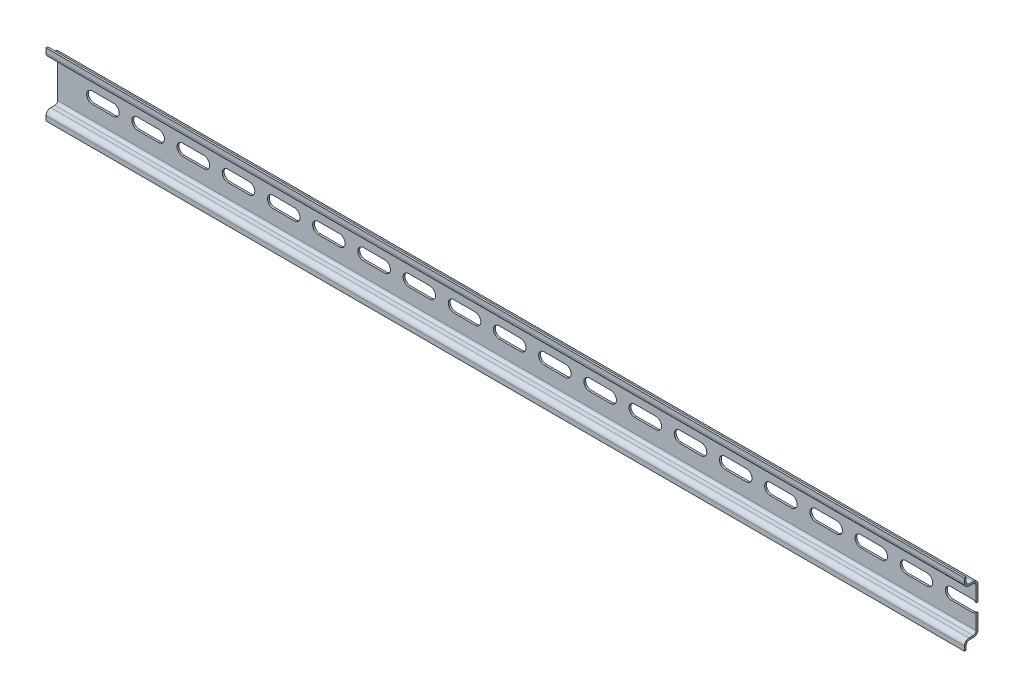
from build123d import *

# Parameters (mm, degrees)
BOSS_EXTRUDE1_DEPTH     = 1000
CUT_EXTRUDE1_DEPTH      = 1001.181688833
FILLET1_R               = 2.54
FILLET2_R               = 1.524
CUT_EXTRUDE2_DEPTH      = 1001.181688833
CUT_EXTRUDE2_DEPTH_BACK = 1001.181688833
SKETCH3_W               = 492
SKETCH3_H               = 35.052


with BuildPart() as part:
    # Sketch1 → Boss-Extrude1 (new body)
    with BuildSketch(Plane(origin=(0, 0, 0), x_dir=(0, 0, -1), z_dir=(1, 0, 0))):
        Polygon((0, 12.446), (0, -12.446), (-6.484, -12.446), (-6.484, -17.526), (-5.484, -17.526), (-5.484, -13.462), (1.016, -13.462), (1.016, 13.462), (-5.484, 13.462), (-5.484, 17.526), (-6.484, 17.526), (-6.484, 12.446), align=None)
    extrude(amount=BOSS_EXTRUDE1_DEPTH)

    # Sketch2 → Cut-Extrude1 (cut, through all)
    with BuildSketch(Plane(origin=(0, 0, -1.016), x_dir=(-1, 0, 0), z_dir=(0, 0, -1))):
        with BuildLine():
            Line((-980.825, 3.175), (-969.175, 3.175))
            ThreePointArc((-969.175, 3.175), (-966, 0), (-969.175, -3.175))
            Line((-969.175, -3.175), (-980.825, -3.175))
            ThreePointArc((-980.825, -3.175), (-984, 0), (-980.825, 3.175))
        make_face()
        with BuildLine():
            Line((-955.824999962, 3.175), (-944.174999962, 3.175))
            ThreePointArc((-944.174999962, 3.175), (-940.999999962, 0), (-944.174999962, -3.175))
            Line((-944.174999962, -3.175), (-955.824999962, -3.175))
            ThreePointArc((-955.824999962, -3.175), (-958.999999962, 0), (-955.824999962, 3.175))
        make_face()
        with BuildLine():
            Line((-930.824999924, 3.175), (-919.174999924, 3.175))
            ThreePointArc((-919.174999924, 3.175), (-915.999999924, 0), (-919.174999924, -3.175))
            Line((-919.174999924, -3.175), (-930.824999924, -3.175))
            ThreePointArc((-930.824999924, -3.175), (-933.999999924, 0), (-930.824999924, 3.175))
        make_face()
        with BuildLine():
            Line((-905.824999886, 3.175), (-894.174999886, 3.175))
            ThreePointArc((-894.174999886, 3.175), (-890.999999886, 0), (-894.174999886, -3.175))
            Line((-894.174999886, -3.175), (-905.824999886, -3.175))
            ThreePointArc((-905.824999886, -3.175), (-908.999999886, 0), (-905.824999886, 3.175))
        make_face()
        with BuildLine():
            Line((-880.824999848, 3.175), (-869.174999848, 3.175))
            ThreePointArc((-869.174999848, 3.175), (-865.999999848, 0), (-869.174999848, -3.175))
            Line((-869.174999848, -3.175), (-880.824999848, -3.175))
            ThreePointArc((-880.824999848, -3.175), (-883.999999848, 0), (-880.824999848, 3.175))
        make_face()
        with BuildLine():
            Line((-855.82499981, 3.175), (-844.17499981, 3.175))
            ThreePointArc((-844.17499981, 3.175), (-840.99999981, 0), (-844.17499981, -3.175))
            Line((-844.17499981, -3.175), (-855.82499981, -3.175))
            ThreePointArc((-855.82499981, -3.175), (-858.99999981, 0), (-855.82499981, 3.175))
        make_face()
        with BuildLine():
            Line((-830.824999772, 3.175), (-819.174999772, 3.175))
            ThreePointArc((-819.174999772, 3.175), (-815.999999772, 0), (-819.174999772, -3.175))
            Line((-819.174999772, -3.175), (-830.824999772, -3.175))
            ThreePointArc((-830.824999772, -3.175), (-833.999999772, 0), (-830.824999772, 3.175))
        make_face()
        with BuildLine():
            Line((-805.824999734, 3.175), (-794.174999734, 3.175))
            ThreePointArc((-794.174999734, 3.175), (-790.999999734, 0), (-794.174999734, -3.175))
            Line((-794.174999734, -3.175), (-805.824999734, -3.175))
            ThreePointArc((-805.824999734, -3.175), (-808.999999734, 0), (-805.824999734, 3.175))
        make_face()
        with BuildLine():
            Line((-780.824999696, 3.175), (-769.174999696, 3.175))
            ThreePointArc((-769.174999696, 3.175), (-765.999999696, 0), (-769.174999696, -3.175))
            Line((-769.174999696, -3.175), (-780.824999696, -3.175))
            ThreePointArc((-780.824999696, -3.175), (-783.999999696, 0), (-780.824999696, 3.175))
        make_face()
        with BuildLine():
            Line((-755.824999658, 3.175), (-744.174999658, 3.175))
            ThreePointArc((-744.174999658, 3.175), (-740.999999658, 0), (-744.174999658, -3.175))
            Line((-744.174999658, -3.175), (-755.824999658, -3.175))
            ThreePointArc((-755.824999658, -3.175), (-758.999999658, 0), (-755.824999658, 3.175))
        make_face()
        with BuildLine():
            Line((-730.82499962, 3.175), (-719.17499962, 3.175))
            ThreePointArc((-719.17499962, 3.175), (-715.99999962, 0), (-719.17499962, -3.175))
            Line((-719.17499962, -3.175), (-730.82499962, -3.175))
            ThreePointArc((-730.82499962, -3.175), (-733.99999962, 0), (-730.82499962, 3.175))
        make_face()
        with BuildLine():
            Line((-705.824999582, 3.175), (-694.174999582, 3.175))
            ThreePointArc((-694.174999582, 3.175), (-690.999999582, 0), (-694.174999582, -3.175))
            Line((-694.174999582, -3.175), (-705.824999582, -3.175))
            ThreePointArc((-705.824999582, -3.175), (-708.999999582, 0), (-705.824999582, 3.175))
        make_face()
        with BuildLine():
            Line((-680.824999544, 3.175), (-669.174999544, 3.175))
            ThreePointArc((-669.174999544, 3.175), (-665.999999544, 0), (-669.174999544, -3.175))
            Line((-669.174999544, -3.175), (-680.824999544, -3.175))
            ThreePointArc((-680.824999544, -3.175), (-683.999999544, 0), (-680.824999544, 3.175))
        make_face()
        with BuildLine():
            Line((-655.824999506, 3.175), (-644.174999506, 3.175))
            ThreePointArc((-644.174999506, 3.175), (-640.999999506, 0), (-644.174999506, -3.175))
            Line((-644.174999506, -3.175), (-655.824999506, -3.175))
            ThreePointArc((-655.824999506, -3.175), (-658.999999506, 0), (-655.824999506, 3.175))
        make_face()
        with BuildLine():
            Line((-630.824999468, 3.175), (-619.174999468, 3.175))
            ThreePointArc((-619.174999468, 3.175), (-615.999999468, 0), (-619.174999468, -3.175))
            Line((-619.174999468, -3.175), (-630.824999468, -3.175))
            ThreePointArc((-630.824999468, -3.175), (-633.999999468, 0), (-630.824999468, 3.175))
        make_face()
        with BuildLine():
            Line((-605.82499943, 3.175), (-594.17499943, 3.175))
            ThreePointArc((-594.17499943, 3.175), (-590.99999943, 0), (-594.17499943, -3.175))
            Line((-594.17499943, -3.175), (-605.82499943, -3.175))
            ThreePointArc((-605.82499943, -3.175), (-608.99999943, 0), (-605.82499943, 3.175))
        make_face()
        with BuildLine():
            Line((-580.824999392, 3.175), (-569.174999392, 3.175))
            ThreePointArc((-569.174999392, 3.175), (-565.999999392, 0), (-569.174999392, -3.175))
            Line((-569.174999392, -3.175), (-580.824999392, -3.175))
            ThreePointArc((-580.824999392, -3.175), (-583.999999392, 0), (-580.824999392, 3.175))
        make_face()
        with BuildLine():
            Line((-555.824999354, 3.175), (-544.174999354, 3.175))
            ThreePointArc((-544.174999354, 3.175), (-540.999999354, 0), (-544.174999354, -3.175))
            Line((-544.174999354, -3.175), (-555.824999354, -3.175))
            ThreePointArc((-555.824999354, -3.175), (-558.999999354, 0), (-555.824999354, 3.175))
        make_face()
        with BuildLine():
            Line((-530.824999316, 3.175), (-519.174999316, 3.175))
            ThreePointArc((-519.174999316, 3.175), (-515.999999316, 0), (-519.174999316, -3.175))
            Line((-519.174999316, -3.175), (-530.824999316, -3.175))
            ThreePointArc((-530.824999316, -3.175), (-533.999999316, 0), (-530.824999316, 3.175))
        make_face()
        with BuildLine():
            Line((-505.824999278, 3.175), (-494.174999278, 3.175))
            ThreePointArc((-494.174999278, 3.175), (-490.999999278, 0), (-494.174999278, -3.175))
            Line((-494.174999278, -3.175), (-505.824999278, -3.175))
            ThreePointArc((-505.824999278, -3.175), (-508.999999278, 0), (-505.824999278, 3.175))
        make_face()
        with BuildLine():
            Line((-480.82499924, 3.175), (-469.17499924, 3.175))
            ThreePointArc((-469.17499924, 3.175), (-465.99999924, 0), (-469.17499924, -3.175))
            Line((-469.17499924, -3.175), (-480.82499924, -3.175))
            ThreePointArc((-480.82499924, -3.175), (-483.99999924, 0), (-480.82499924, 3.175))
        make_face()
        with BuildLine():
            Line((-455.824999202, 3.175), (-444.174999202, 3.175))
            ThreePointArc((-444.174999202, 3.175), (-440.999999202, 0), (-444.174999202, -3.175))
            Line((-444.174999202, -3.175), (-455.824999202, -3.175))
            ThreePointArc((-455.824999202, -3.175), (-458.999999202, 0), (-455.824999202, 3.175))
        make_face()
        with BuildLine():
            Line((-430.824999164, 3.175), (-419.174999164, 3.175))
            ThreePointArc((-419.174999164, 3.175), (-415.999999164, 0), (-419.174999164, -3.175))
            Line((-419.174999164, -3.175), (-430.824999164, -3.175))
            ThreePointArc((-430.824999164, -3.175), (-433.999999164, 0), (-430.824999164, 3.175))
        make_face()
        with BuildLine():
            Line((-405.824999126, 3.175), (-394.174999126, 3.175))
            ThreePointArc((-394.174999126, 3.175), (-390.999999126, 0), (-394.174999126, -3.175))
            Line((-394.174999126, -3.175), (-405.824999126, -3.175))
            ThreePointArc((-405.824999126, -3.175), (-408.999999126, 0), (-405.824999126, 3.175))
        make_face()
        with BuildLine():
            Line((-380.824999088, 3.175), (-369.174999088, 3.175))
            ThreePointArc((-369.174999088, 3.175), (-365.999999088, 0), (-369.174999088, -3.175))
            Line((-369.174999088, -3.175), (-380.824999088, -3.175))
            ThreePointArc((-380.824999088, -3.175), (-383.999999088, 0), (-380.824999088, 3.175))
        make_face()
        with BuildLine():
            Line((-355.82499905, 3.175), (-344.17499905, 3.175))
            ThreePointArc((-344.17499905, 3.175), (-340.99999905, 0), (-344.17499905, -3.175))
            Line((-344.17499905, -3.175), (-355.82499905, -3.175))
            ThreePointArc((-355.82499905, -3.175), (-358.99999905, 0), (-355.82499905, 3.175))
        make_face()
        with BuildLine():
            Line((-330.824999012, 3.175), (-319.174999012, 3.175))
            ThreePointArc((-319.174999012, 3.175), (-315.999999012, 0), (-319.174999012, -3.175))
            Line((-319.174999012, -3.175), (-330.824999012, -3.175))
            ThreePointArc((-330.824999012, -3.175), (-333.999999012, 0), (-330.824999012, 3.175))
        make_face()
        with BuildLine():
            Line((-305.824998974, 3.175), (-294.174998974, 3.175))
            ThreePointArc((-294.174998974, 3.175), (-290.999998974, 0), (-294.174998974, -3.175))
            Line((-294.174998974, -3.175), (-305.824998974, -3.175))
            ThreePointArc((-305.824998974, -3.175), (-308.999998974, 0), (-305.824998974, 3.175))
        make_face()
        with BuildLine():
            Line((-280.824998936, 3.175), (-269.174998936, 3.175))
            ThreePointArc((-269.174998936, 3.175), (-265.999998936, 0), (-269.174998936, -3.175))
            Line((-269.174998936, -3.175), (-280.824998936, -3.175))
            ThreePointArc((-280.824998936, -3.175), (-283.999998936, 0), (-280.824998936, 3.175))
        make_face()
        with BuildLine():
            Line((-255.824998898, 3.175), (-244.174998898, 3.175))
            ThreePointArc((-244.174998898, 3.175), (-240.999998898, 0), (-244.174998898, -3.175))
            Line((-244.174998898, -3.175), (-255.824998898, -3.175))
            ThreePointArc((-255.824998898, -3.175), (-258.999998898, 0), (-255.824998898, 3.175))
        make_face()
        with BuildLine():
            Line((-230.82499886, 3.175), (-219.17499886, 3.175))
            ThreePointArc((-219.17499886, 3.175), (-215.99999886, 0), (-219.17499886, -3.175))
            Line((-219.17499886, -3.175), (-230.82499886, -3.175))
            ThreePointArc((-230.82499886, -3.175), (-233.99999886, 0), (-230.82499886, 3.175))
        make_face()
        with BuildLine():
            Line((-205.824998822, 3.175), (-194.174998822, 3.175))
            ThreePointArc((-194.174998822, 3.175), (-190.999998822, 0), (-194.174998822, -3.175))
            Line((-194.174998822, -3.175), (-205.824998822, -3.175))
            ThreePointArc((-205.824998822, -3.175), (-208.999998822, 0), (-205.824998822, 3.175))
        make_face()
        with BuildLine():
            Line((-180.824998784, 3.175), (-169.174998784, 3.175))
            ThreePointArc((-169.174998784, 3.175), (-165.999998784, 0), (-169.174998784, -3.175))
            Line((-169.174998784, -3.175), (-180.824998784, -3.175))
            ThreePointArc((-180.824998784, -3.175), (-183.999998784, 0), (-180.824998784, 3.175))
        make_face()
        with BuildLine():
            Line((-155.824998746, 3.175), (-144.174998746, 3.175))
            ThreePointArc((-144.174998746, 3.175), (-140.999998746, 0), (-144.174998746, -3.175))
            Line((-144.174998746, -3.175), (-155.824998746, -3.175))
            ThreePointArc((-155.824998746, -3.175), (-158.999998746, 0), (-155.824998746, 3.175))
        make_face()
        with BuildLine():
            Line((-130.824998708, 3.175), (-119.174998708, 3.175))
            ThreePointArc((-119.174998708, 3.175), (-115.999998708, 0), (-119.174998708, -3.175))
            Line((-119.174998708, -3.175), (-130.824998708, -3.175))
            ThreePointArc((-130.824998708, -3.175), (-133.999998708, 0), (-130.824998708, 3.175))
        make_face()
        with BuildLine():
            Line((-105.82499867, 3.175), (-94.17499867, 3.175))
            ThreePointArc((-94.17499867, 3.175), (-90.99999867, 0), (-94.17499867, -3.175))
            Line((-94.17499867, -3.175), (-105.82499867, -3.175))
            ThreePointArc((-105.82499867, -3.175), (-108.99999867, 0), (-105.82499867, 3.175))
        make_face()
        with BuildLine():
            Line((-80.824998632, 3.175), (-69.174998632, 3.175))
            ThreePointArc((-69.174998632, 3.175), (-65.999998632, 0), (-69.174998632, -3.175))
            Line((-69.174998632, -3.175), (-80.824998632, -3.175))
            ThreePointArc((-80.824998632, -3.175), (-83.999998632, 0), (-80.824998632, 3.175))
        make_face()
        with BuildLine():
            Line((-55.824998594, 3.175), (-44.174998594, 3.175))
            ThreePointArc((-44.174998594, 3.175), (-40.999998594, 0), (-44.174998594, -3.175))
            Line((-44.174998594, -3.175), (-55.824998594, -3.175))
            ThreePointArc((-55.824998594, -3.175), (-58.999998594, 0), (-55.824998594, 3.175))
        make_face()
        with BuildLine():
            Line((-30.824998556, 3.175), (-19.174998556, 3.175))
            ThreePointArc((-19.174998556, 3.175), (-15.999998556, 0), (-19.174998556, -3.175))
            Line((-19.174998556, -3.175), (-30.824998556, -3.175))
            ThreePointArc((-30.824998556, -3.175), (-33.999998556, 0), (-30.824998556, 3.175))
        make_face()
    extrude(amount=-CUT_EXTRUDE1_DEPTH, mode=Mode.SUBTRACT)

    # Fillet1
    fillet1_edges = [part.edges().sort_by_distance(p)[0] for p in [
        (500, 13.462, -1.016),
        (500, -13.462, -1.016),
        (500, -12.446, 6.484),
        (500, 12.446, 6.484),
    ]]
    fillet(fillet1_edges, radius=FILLET1_R)

    # Fillet2
    fillet2_edges = [part.edges().sort_by_distance(p)[0] for p in [
        (500, 13.462, 5.484),
        (500, -13.462, 5.484),
        (500, -12.446, 0),
        (500, 12.446, 0),
    ]]
    fillet(fillet2_edges, radius=FILLET2_R)

    # Sketch3 → Cut-Extrude2 (cut, two sides: drawn at the far end of the back side and taken through both)
    with BuildSketch(Plane(origin=(0, 0, -1.016), x_dir=(-1, 0, 0), z_dir=(0, 0, -1)).offset(-CUT_EXTRUDE2_DEPTH_BACK)):
        with Locations((-754, 0)):
            Rectangle(SKETCH3_W, SKETCH3_H)
    extrude(amount=CUT_EXTRUDE2_DEPTH + CUT_EXTRUDE2_DEPTH_BACK, mode=Mode.SUBTRACT)


solid = part.part
